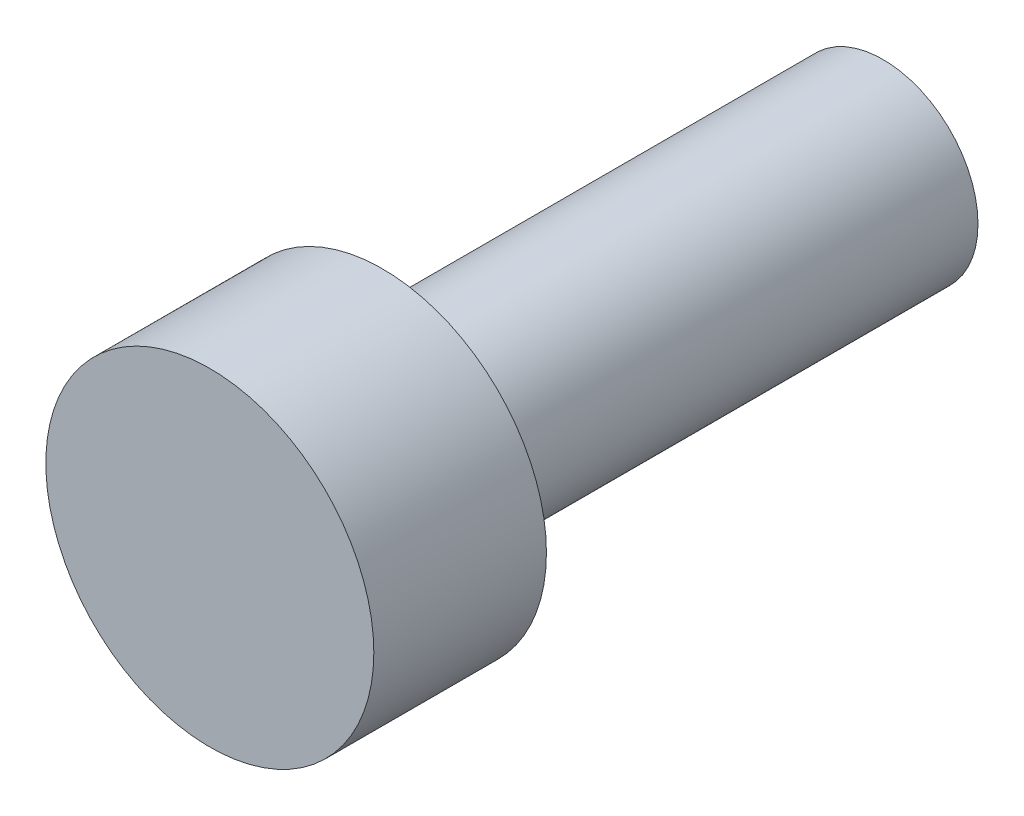
from build123d import *

# Parameters (mm, degrees)
SKETCH1_R           = 3.4925
SKETCH1_R_2         = 0.8509
BOSS_EXTRUDE1_DEPTH = 15.875
SKETCH2_R           = 3.4925
BOSS_EXTRUDE2_DEPTH = 2.54
SKETCH3_R           = 6.0325
BOSS_EXTRUDE3_DEPTH = 6.35
SKETCH4_R           = 0.889
CUT_EXTRUDE1_DEPTH  = 3.5


with BuildPart() as part:
    # Sketch1 → Boss-Extrude1 (new body)
    with BuildSketch(Plane.XY):
        Circle(SKETCH1_R)
        Circle(SKETCH1_R_2, mode=Mode.SUBTRACT)
    extrude(amount=BOSS_EXTRUDE1_DEPTH)

    # Sketch2 → Boss-Extrude2 (add)
    with BuildSketch(Plane.XY.offset(15.875)):
        Circle(SKETCH2_R)
    extrude(amount=BOSS_EXTRUDE2_DEPTH)

    # Sketch3 → Boss-Extrude3 (add)
    with BuildSketch(Plane.XY.offset(18.415)):
        Circle(SKETCH3_R)
    extrude(amount=BOSS_EXTRUDE3_DEPTH)

    # Sketch4 → Cut-Extrude1 (cut)
    with BuildSketch(Plane.ZY.offset(3.4925)):
        with Locations((2.54, 0)):
            Circle(SKETCH4_R)
        with Locations((8.89, 0)):
            Circle(SKETCH4_R)
    extrude(amount=-CUT_EXTRUDE1_DEPTH, mode=Mode.SUBTRACT)


solid = part.part
